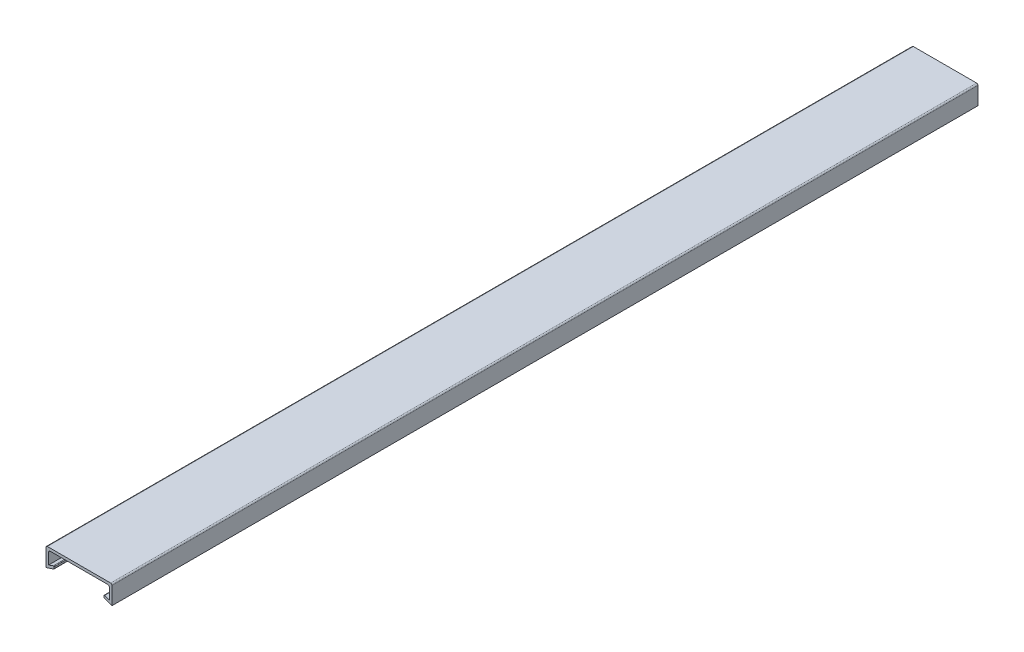
from build123d import *

# Parameters (mm, degrees)
SALIENTE_EXTRUIR1_DEPTH = 160


with BuildPart() as part:
    # Croquis1 → Saliente-Extruir1 (new, symmetric)
    with BuildSketch(Plane.XY):
        with BuildLine():
            Line((-9.336754447, -6.045584816), (-12.2, -7))
            Line((-12.2, -7), (-12.2, -0.5))
            ThreePointArc((-12.2, -0.5), (-12.053553391, -0.146446609), (-11.7, 0))
            Line((-11.7, 0), (11.7, 0))
            ThreePointArc((11.7, 0), (12.053553391, -0.146446609), (12.2, -0.5))
            Line((12.2, -0.5), (12.2, -7))
            Line((12.2, -7), (9.336754447, -6.045584816))
            ThreePointArc((9.336754447, -6.045584816), (9.237751563, -5.972790213), (9.2, -5.855848156))
            Line((9.2, -5.855848156), (9.2, -5.277485177))
            ThreePointArc((9.2, -5.277485177), (9.283057943, -5.11523674), (9.463245553, -5.087748518))
            Line((9.463245553, -5.087748518), (11.2, -5.666666667))
            Line((11.2, -5.666666667), (11.2, -1.5))
            ThreePointArc((11.2, -1.5), (11.053553391, -1.146446609), (10.7, -1))
            Line((10.7, -1), (-10.7, -1))
            ThreePointArc((-10.7, -1), (-11.053553391, -1.146446609), (-11.2, -1.5))
            Line((-11.2, -1.5), (-11.2, -5.666666667))
            Line((-11.2, -5.666666667), (-9.463245553, -5.087748518))
            ThreePointArc((-9.463245553, -5.087748518), (-9.283057943, -5.11523674), (-9.2, -5.277485177))
            Line((-9.2, -5.277485177), (-9.2, -5.855848156))
            ThreePointArc((-9.2, -5.855848156), (-9.237751563, -5.972790213), (-9.336754447, -6.045584816))
        make_face()
    extrude(amount=SALIENTE_EXTRUIR1_DEPTH, both=True)


solid = part.part
